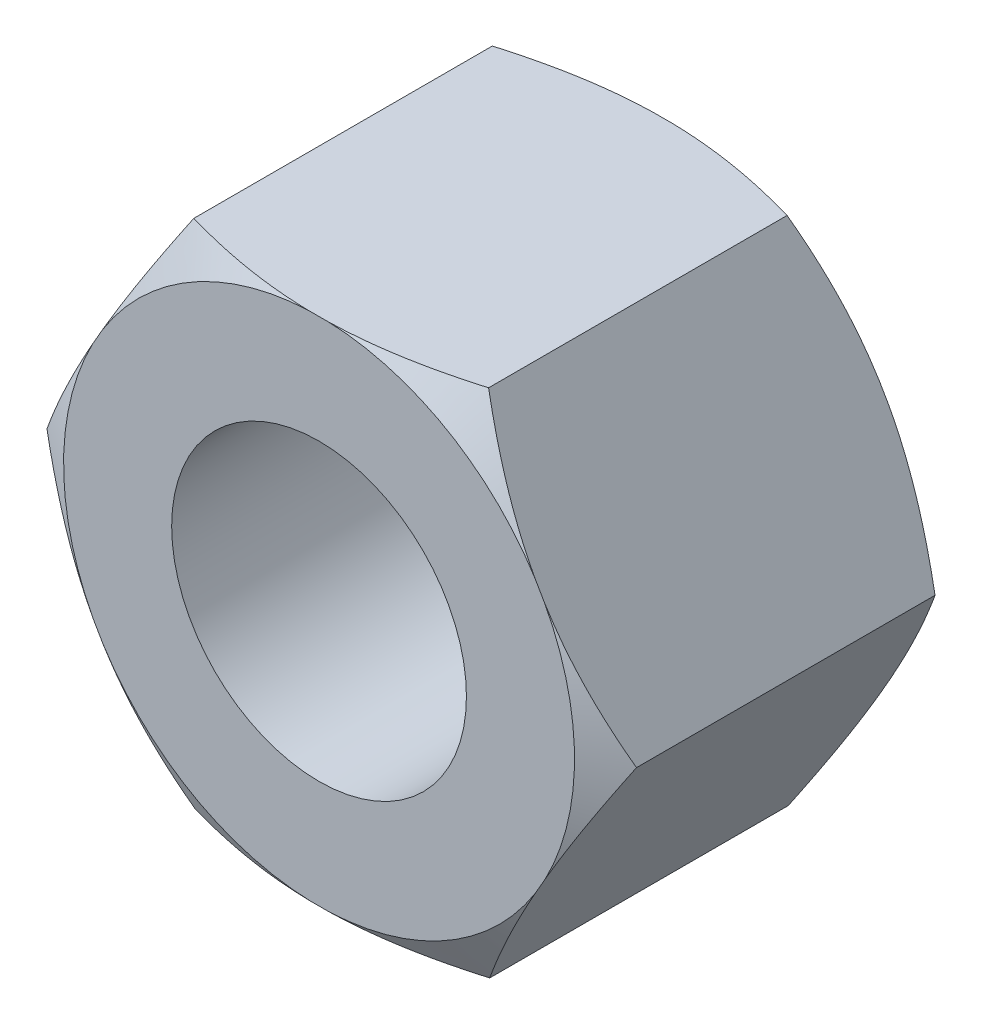
from build123d import *

# Parameters (mm, degrees)
SKETCH1_R           = 15
BOSS_EXTRUDE1_DEPTH = 35
SKETCH3_OUTSIDE_W   = 200.6
SKETCH3_OUTSIDE_H   = 192.626
SKETCH3_OUTSIDE_R   = 26
CUT_EXTRUDE1_DEPTH  = 35
CUT_EXTRUDE1_DRAFT  = -60
SKETCH4_OUTSIDE_W   = 200.6
SKETCH4_OUTSIDE_H   = 192.626
SKETCH4_OUTSIDE_R   = 26
CUT_EXTRUDE2_DEPTH  = 35
CUT_EXTRUDE2_DRAFT  = -60


with BuildPart() as part:
    # Sketch1 → Boss-Extrude1 (new body)
    with BuildSketch(Plane.XY):
        Polygon((14.943467474, 26.013401183), (-15.056532526, 25.948123045), (-30, -0.065278138), (-14.943467474, -26.013401183), (15.056532526, -25.948123045), (30, 0.065278138), align=None)
        Circle(SKETCH1_R, mode=Mode.SUBTRACT)
    extrude(amount=BOSS_EXTRUDE1_DEPTH)


with BuildPart() as cut_extrude1_tool:
    # Sketch3 outside → Cut-Extrude1 (with draft: the straight prism first)
    with BuildSketch(Plane(origin=(0, 0, 0), x_dir=(-1, 0, 0), z_dir=(0, 0, -1))):
        Rectangle(SKETCH3_OUTSIDE_W, SKETCH3_OUTSIDE_H)
        Circle(SKETCH3_OUTSIDE_R, mode=Mode.SUBTRACT)
    extrude(amount=-CUT_EXTRUDE1_DEPTH)
    # Cut-Extrude1: the draft: its side faces are tilted about the plane it starts from
    cut_extrude1_sides = [cut_extrude1_tool.faces().sort_by_distance(p)[0] for p in [
        (0, -96.313, 17.5),
        (-100.3, 0, 17.5),
        (0, 96.313, 17.5),
        (100.3, 0, 17.5),
        (26, 0, 17.5),
    ]]
    draft(cut_extrude1_sides, Plane(origin=(0, 0, 0), x_dir=(-1, 0, 0), z_dir=(0, 0, -1)), CUT_EXTRUDE1_DRAFT)


with BuildPart() as part_1:
    add(part.part)

    # Cut-Extrude1: cut by cut_extrude1_tool
    add(cut_extrude1_tool.part, mode=Mode.SUBTRACT)


with BuildPart() as cut_extrude2_tool:
    # Sketch4 outside → Cut-Extrude2 (with draft: the straight prism first)
    with BuildSketch(Plane.XY.offset(35)):
        Rectangle(SKETCH4_OUTSIDE_W, SKETCH4_OUTSIDE_H)
        Circle(SKETCH4_OUTSIDE_R, mode=Mode.SUBTRACT)
    extrude(amount=-CUT_EXTRUDE2_DEPTH)
    # Cut-Extrude2: the draft: its side faces are tilted about the plane it starts from
    cut_extrude2_sides = [cut_extrude2_tool.faces().sort_by_distance(p)[0] for p in [
        (0, -96.313, 17.5),
        (100.3, 0, 17.5),
        (0, 96.313, 17.5),
        (-100.3, 0, 17.5),
        (-26, 0, 17.5),
    ]]
    draft(cut_extrude2_sides, Plane.XY.offset(35), CUT_EXTRUDE2_DRAFT)


with BuildPart() as part_2:
    add(part_1.part)

    # Cut-Extrude2: cut by cut_extrude2_tool
    add(cut_extrude2_tool.part, mode=Mode.SUBTRACT)


solid = part_2.part
